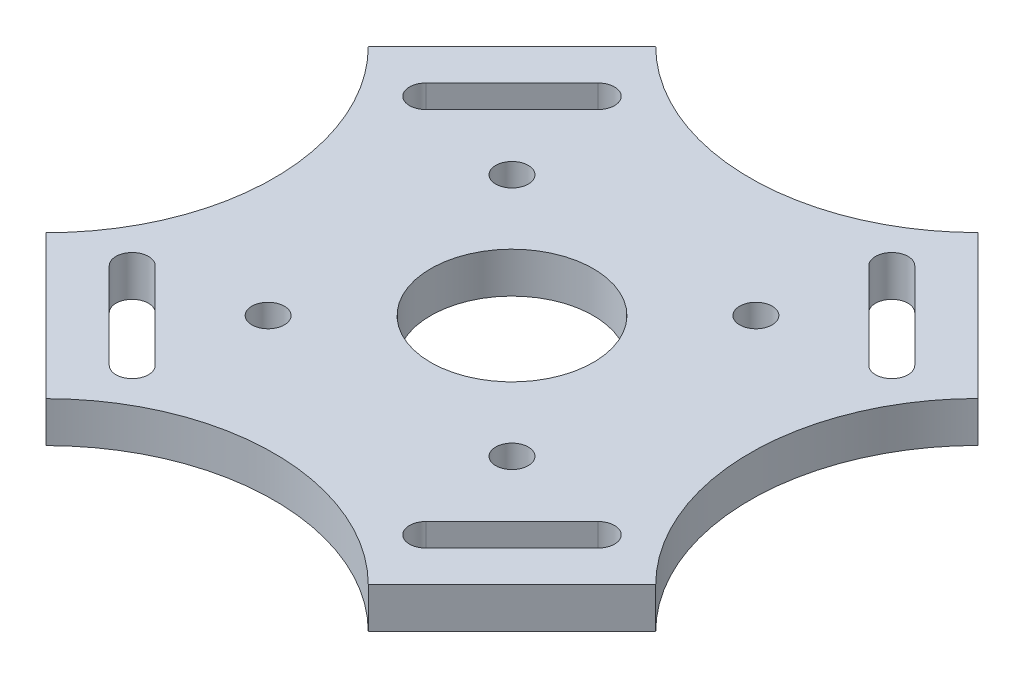
from build123d import *

# Parameters (mm, degrees)
SKETCH2_R           = 10
SKETCH2_R_2         = 2
BOSS_EXTRUDE1_DEPTH = 5


with BuildPart() as part:
    # Sketch2 → Boss-Extrude1 (new body)
    with BuildSketch(Plane(origin=(0, 0, 0), x_dir=(1, 0, 0), z_dir=(0, 1, 0))):
        with BuildLine():
            Line((18.784202094, 41.553321118), (36.461871623, 23.875651588))
            ThreePointArc((36.461871623, 23.875651588), (28.251193505, 4.053321118), (36.461871623, -15.769009352))
            Line((36.461871623, -15.769009352), (18.784202094, -33.446678882))
            ThreePointArc((18.784202094, -33.446678882), (-1.033353761, -25.252275183), (-20.844173422, -33.462950938))
            Line((-20.844173422, -33.462950938), (-38.521842951, -15.785281409))
            ThreePointArc((-38.521842951, -15.785281409), (-30.311167196, 4.048559871), (-38.538128377, 23.875651588))
            Line((-38.538128377, 23.875651588), (-20.860458847, 41.553321118))
            ThreePointArc((-20.860458847, 41.553321118), (-1.038128377, 33.342642999), (18.784202094, 41.553321118))
        make_face()
        with Locations(Location((-1.038128377, 4.053321118, 0), (0, 0, 270))):
            Circle(SKETCH2_R, mode=Mode.SUBTRACT)
        with Locations(Location((-16.038128377, 19.053321118, 0), (0, 0, 270))):
            Circle(SKETCH2_R_2, mode=Mode.SUBTRACT)
        with Locations(Location((13.961871623, 19.053321118, 0), (0, 0, 270))):
            Circle(SKETCH2_R_2, mode=Mode.SUBTRACT)
        with Locations(Location((13.961871623, -10.946678882, 0), (0, 0, 270))):
            Circle(SKETCH2_R_2, mode=Mode.SUBTRACT)
        with Locations(Location((-16.038128377, -10.946678882, 0), (0, 0, 270))):
            Circle(SKETCH2_R_2, mode=Mode.SUBTRACT)
        with BuildLine():
            Line((-17.678478332, 31.300272791), (-28.28508005, 20.693671073))
            ThreePointArc((-28.28508005, 20.693671073), (-31.113507174, 20.693671073), (-31.113507174, 23.522098198))
            Line((-31.113507174, 23.522098198), (-20.506905456, 34.128699916))
            ThreePointArc((-20.506905456, 34.128699916), (-17.678478332, 34.128699916), (-17.678478332, 31.300272791))
        make_face(mode=Mode.SUBTRACT)
        with BuildLine():
            Line((29.037250421, 23.522098198), (18.430648703, 34.128699916))
            ThreePointArc((18.430648703, 34.128699916), (15.602221578, 34.128699916), (15.602221578, 31.300272791))
            Line((15.602221578, 31.300272791), (26.208823296, 20.693671073))
            ThreePointArc((26.208823296, 20.693671073), (29.037250421, 20.693671073), (29.037250421, 23.522098198))
        make_face(mode=Mode.SUBTRACT)
        with BuildLine():
            Line((18.430648703, -26.022057679), (29.037250421, -15.415455962))
            ThreePointArc((29.037250421, -15.415455962), (29.037250421, -12.587028837), (26.208823296, -12.587028837))
            Line((26.208823296, -12.587028837), (15.602221578, -23.193630555))
            ThreePointArc((15.602221578, -23.193630555), (15.602221578, -26.022057679), (18.430648703, -26.022057679))
        make_face(mode=Mode.SUBTRACT)
        with BuildLine():
            Line((-31.113507174, -15.415455962), (-20.506905456, -26.022057679))
            ThreePointArc((-20.506905456, -26.022057679), (-17.678478332, -26.022057679), (-17.678478332, -23.193630555))
            Line((-17.678478332, -23.193630555), (-28.28508005, -12.587028837))
            ThreePointArc((-28.28508005, -12.587028837), (-31.113507174, -12.587028837), (-31.113507174, -15.415455962))
        make_face(mode=Mode.SUBTRACT)
    extrude(amount=BOSS_EXTRUDE1_DEPTH)


solid = part.part
